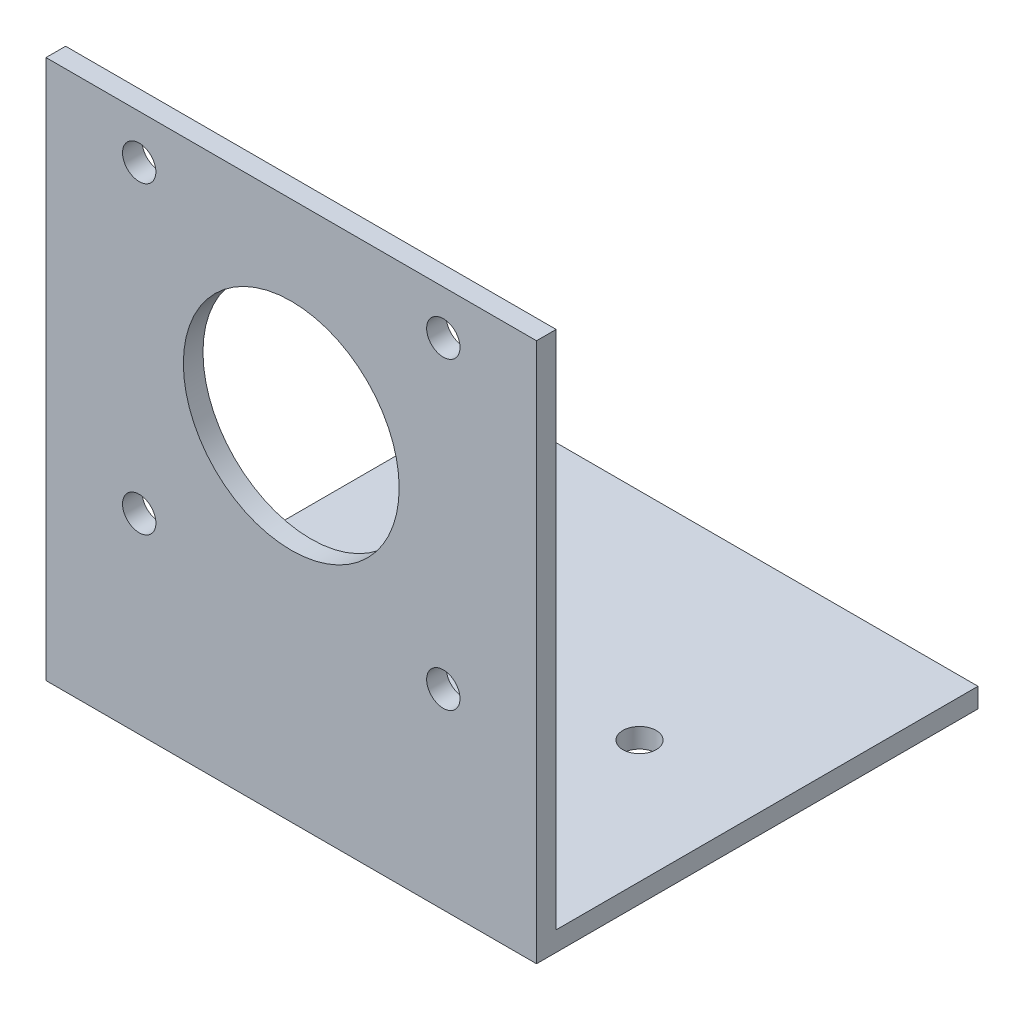
from build123d import *

# Parameters (mm, degrees)
SKETCH1_W                 = 50
SKETCH1_H                 = 55
BOSS_EXTRUDE1_DEPTH       = 2
SKETCH2_W                 = 50
SKETCH2_H                 = 2
BOSS_EXTRUDE2_DEPTH       = 45
CUT_EXTRUDE1_DEPTH        = 76.332595867
CUT_EXTRUDE1_DEPTH_BACK   = 76.332595867
SKETCH3_R                 = 1.7
LO_TAM_D22_DEPTH          = 76.332595867
LO_TAM_D22_DEPTH_BACK     = 76.332595867
SKETCH4_R                 = 11
HAI_LO_CHAN_M3_DEPTH      = 76.332595867
HAI_LO_CHAN_M3_DEPTH_BACK = 76.332595867
SKETCH5_R                 = 1.7


with BuildPart() as part:
    # Sketch1 → Boss-Extrude1 (new body)
    with BuildSketch(Plane.XY):
        with Locations((0, 27.5)):
            Rectangle(SKETCH1_W, SKETCH1_H)
    extrude(amount=-BOSS_EXTRUDE1_DEPTH)

    # Sketch2 → Boss-Extrude2 (add)
    with BuildSketch(Plane.XY):
        with Locations((0, 1)):
            Rectangle(SKETCH2_W, SKETCH2_H)
    extrude(amount=-BOSS_EXTRUDE2_DEPTH)

    # Sketch3 → Cut-Extrude1 (cut, two sides: drawn at the far end of the back side and taken through both)
    with BuildSketch(Plane.XY.offset(-CUT_EXTRUDE1_DEPTH_BACK)):
        with Locations(Location((-15.5, 19.5, 0), (0, 0, 180))):
            Circle(SKETCH3_R)
        with Locations(Location((-15.5, 50.5, 0), (0, 0, 180))):
            Circle(SKETCH3_R)
        with Locations(Location((15.5, 19.5, 0), (0, 0, 180))):
            Circle(SKETCH3_R)
        with Locations(Location((15.5, 50.5, 0), (0, 0, 180))):
            Circle(SKETCH3_R)
    extrude(amount=CUT_EXTRUDE1_DEPTH + CUT_EXTRUDE1_DEPTH_BACK, mode=Mode.SUBTRACT)

    # Sketch4 → Lo_tam_D22 (cut, two sides: drawn at the far end of the back side and taken through both)
    with BuildSketch(Plane.XY.offset(-LO_TAM_D22_DEPTH_BACK)):
        with Locations(Location((0, 35, 0), (0, 0, 180))):
            Circle(SKETCH4_R)
    extrude(amount=LO_TAM_D22_DEPTH + LO_TAM_D22_DEPTH_BACK, mode=Mode.SUBTRACT)

    # Sketch5 → Hai_lo_chan_M3 (cut, two sides: drawn at the far end of the back side and taken through both)
    with BuildSketch(Plane(origin=(0, 0, 0), x_dir=(1, 0, 0), z_dir=(0, 1, 0)).offset(-HAI_LO_CHAN_M3_DEPTH_BACK)):
        with Locations(Location((-12.5, 23, 0), (0, 0, 270))):
            Circle(SKETCH5_R)
        with Locations(Location((12.5, 23, 0), (0, 0, 270))):
            Circle(SKETCH5_R)
    extrude(amount=HAI_LO_CHAN_M3_DEPTH + HAI_LO_CHAN_M3_DEPTH_BACK, mode=Mode.SUBTRACT)


solid = part.part
